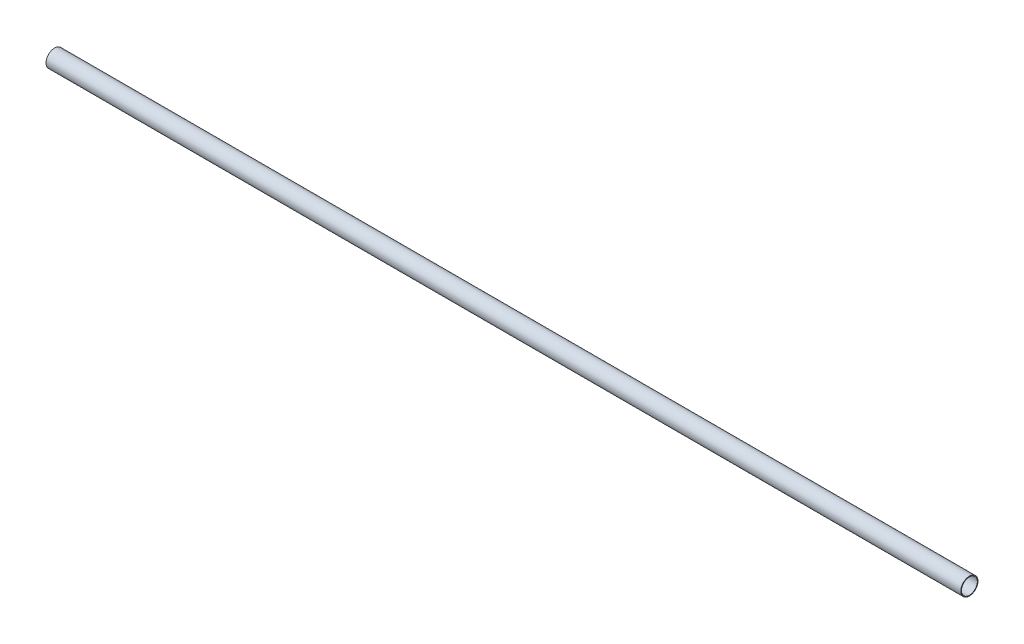
from build123d import *

# Parameters (mm, degrees)
CROQUIS1_R              = 25.4
CROQUIS1_R_2            = 23.4
SALIENTE_EXTRUIR1_DEPTH = 1350
CROQUIS2_R              = 4
CROQUIS2_W              = 2520
CROQUIS2_H              = 10
CORTAR_EXTRUIR1_DEPTH   = 1351.477811739


with BuildPart() as part:
    # Croquis1 → Saliente-Extruir1 (new, symmetric)
    with BuildSketch(Plane(origin=(0, 0, 0), x_dir=(0, 0, -1), z_dir=(1, 0, 0))):
        Circle(CROQUIS1_R)
        Circle(CROQUIS1_R_2, mode=Mode.SUBTRACT)
    extrude(amount=SALIENTE_EXTRUIR1_DEPTH, both=True)

    # Croquis2 → Cortar-Extruir1 (cut, through all)
    with BuildSketch(Plane.XY):
        with Locations((-1339.465777124, 0)):
            Circle(CROQUIS2_R)
        Rectangle(CROQUIS2_W, CROQUIS2_H)
    extrude(amount=-CORTAR_EXTRUIR1_DEPTH, mode=Mode.SUBTRACT)


solid = part.part
